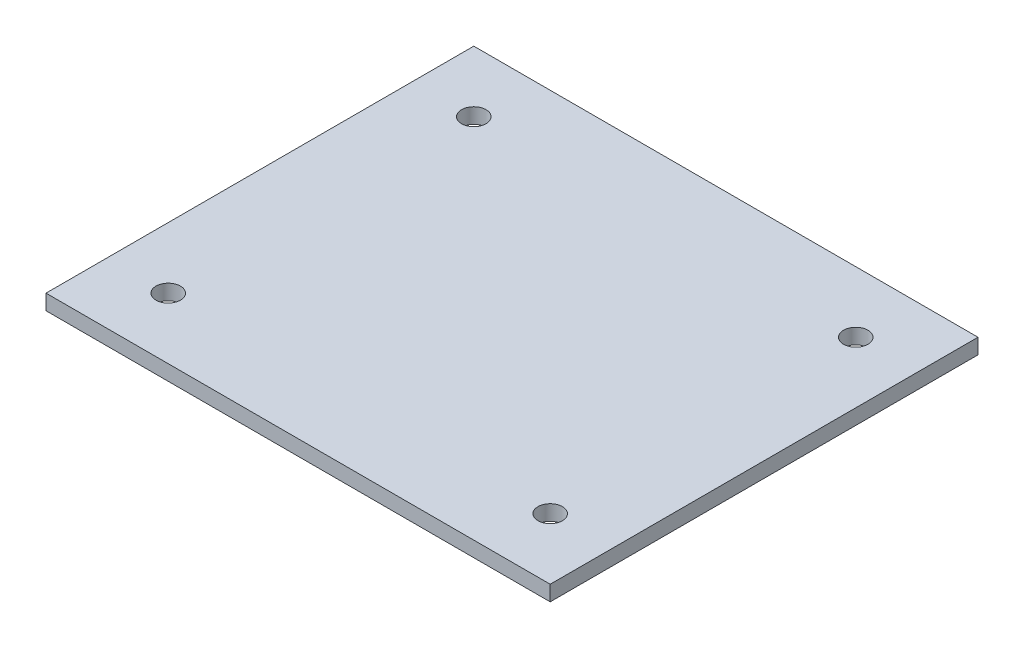
from build123d import *

# Parameters (mm, degrees)
SKETCH_1_W                  = 66
SKETCH_1_H                  = 56
EXTRUDE_1_DEPTH             = 2
SKETCH_2_R                  = 1.6
CUT_EXTRUDE_1_DEPTH         = 2
PATTERN_LINEAR_1_COUNT      = 2
PATTERN_LINEAR_1_PITCH      = 50
PATTERN_LINEAR_1_COUNT_DIR2 = 2
PATTERN_LINEAR_1_PITCH_DIR2 = 40


with BuildPart() as part:
    # 草图1 → 凸台-拉伸1 (new body)
    with BuildSketch(Plane(origin=(0, 0, 0), x_dir=(1, 0, 0), z_dir=(0, 1, 0))):
        Rectangle(SKETCH_1_W, SKETCH_1_H)
    extrude(amount=EXTRUDE_1_DEPTH)

    # 草图2 → 切除-拉伸1 (cut)
    with BuildSketch(Plane(origin=(0, 2, 0), x_dir=(1, 0, 0), z_dir=(0, 1, 0))):
        with Locations(Location((-25, 20, 0), (0, 0, 270))):
            Circle(SKETCH_2_R)
    cut_extrude_1 = extrude(amount=-CUT_EXTRUDE_1_DEPTH, mode=Mode.SUBTRACT)

    # 阵列(线性)1: Cut-Extrude 1 2 × 2
    with Locations(*[(i * PATTERN_LINEAR_1_PITCH, 0, j * PATTERN_LINEAR_1_PITCH_DIR2) for i in range(PATTERN_LINEAR_1_COUNT) for j in range(PATTERN_LINEAR_1_COUNT_DIR2) if (i, j) != (0, 0)]):
        add(cut_extrude_1, mode=Mode.SUBTRACT)


solid = part.part
